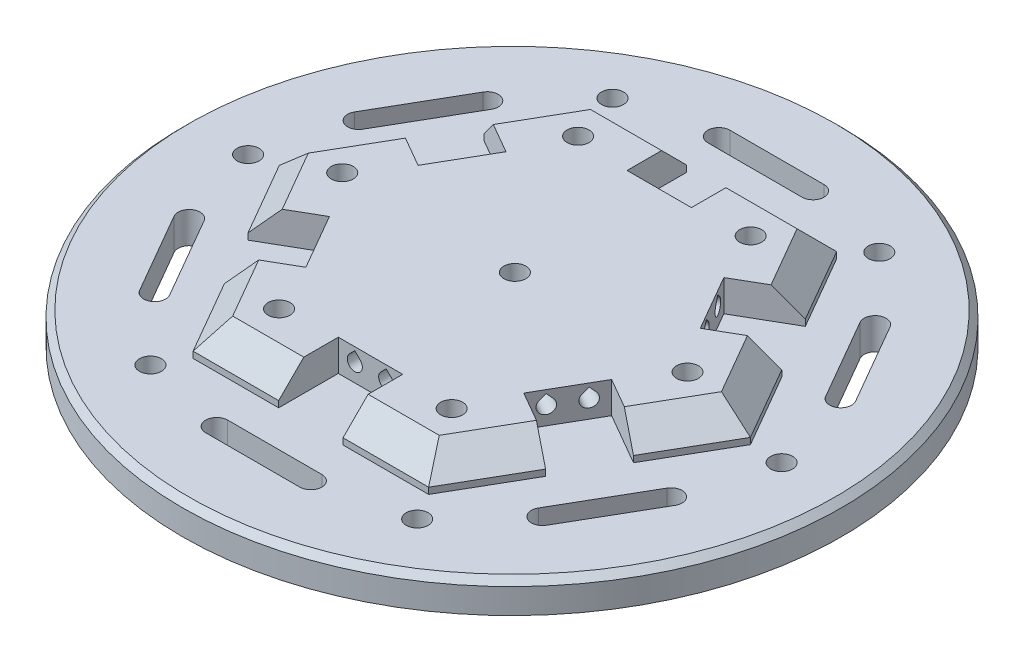
from build123d import *

# Parameters (mm, degrees)
EXTRUDE_1_DEPTH          = 10
CHAMFER_1_SIZE           = 8
SKETCH_1_3_W             = 20.5
SKETCH_1_3_H             = 19
CUT_EXTRUDE_2_DEPTH      = 10
CUT_EXTRUDE_3_DEPTH      = 8.5
PATTERN_CIRCULAR_1_COUNT = 6
SKETCH_9_R               = 105
EXTRUDE_3_DEPTH          = 10
SKETCH_7_R               = 3.5
CUT_EXTRUDE_4_DEPTH      = 151.473378259
CUT_EXTRUDE_5_DEPTH      = 150.473200156
PATTERN_CIRCULAR_2_COUNT = 6
CHAMFER_2_SIZE           = 2
SKETCH_13_R              = 3.5
CUT_EXTRUDE_6_DEPTH      = 151.473378259
PATTERN_CIRCULAR_3_COUNT = 6
CUT_EXTRUDE_7_DEPTH      = 0.6


with BuildPart() as part:
    # 草圖1 → 填料-伸長1 (new body)
    with BuildSketch(Plane(origin=(0, 0, 0), x_dir=(1, 0, 0), z_dir=(0, 1, 0))):
        Polygon((37.527767497, -65), (75.055534995, 0), (37.527767497, 65), (-37.527767497, 65), (-75.055534995, 0), (-37.527767497, -65), align=None)
    extrude(amount=EXTRUDE_1_DEPTH)

    # 導角1
    chamfer_1_edges = [part.edges().sort_by_distance(p)[0] for p in [
        (56.291651246, 10, 32.5),
        (0, 10, 65),
        (-56.291651246, 10, 32.5),
        (-56.291651246, 10, -32.5),
        (0, 10, -65),
        (56.291651246, 10, -32.5),
    ]]
    chamfer(chamfer_1_edges, length=CHAMFER_1_SIZE)

    # 草圖1<3> → 除料-伸長2 (cut)
    with BuildSketch(Plane(origin=(0, 0, 0), x_dir=(1, 0, 0), z_dir=(0, 1, 0))):
        with Locations((0, 55.5)):
            Rectangle(SKETCH_1_3_W, SKETCH_1_3_H)
    cut_extrude_2 = extrude(amount=CUT_EXTRUDE_2_DEPTH, mode=Mode.SUBTRACT)

    # 草圖2 → 除料-伸長3 (cut)
    with BuildSketch(Plane(origin=(0, 0, -46), x_dir=(-1, 0, 0), z_dir=(0, 0, -1))):
        with BuildLine():
            Line((-6.697056275, 7.197056275), (-5, 8.89411255))
            Line((-5, 8.89411255), (-3.302943725, 7.197056275))
            ThreePointArc((-3.302943725, 7.197056275), (-5, 3.1), (-6.697056275, 7.197056275))
        make_face()
        with BuildLine():
            Line((3.302943725, 7.197056275), (5, 8.89411255))
            Line((5, 8.89411255), (6.697056275, 7.197056275))
            ThreePointArc((6.697056275, 7.197056275), (5, 3.1), (3.302943725, 7.197056275))
        make_face()
    cut_extrude_3 = extrude(amount=-CUT_EXTRUDE_3_DEPTH, mode=Mode.SUBTRACT)

    # 環狀複製排列1: 除料-伸長2, 除料-伸長3 ×6 about axis
    pattern_circular_1_axis = Axis((0, 10.5, 0), (0, -1, 0))
    add([cut_extrude_2.rotate(pattern_circular_1_axis, i * 360 / PATTERN_CIRCULAR_1_COUNT) for i in range(1, PATTERN_CIRCULAR_1_COUNT)], mode=Mode.SUBTRACT)
    add([cut_extrude_3.rotate(pattern_circular_1_axis, i * 360 / PATTERN_CIRCULAR_1_COUNT) for i in range(1, PATTERN_CIRCULAR_1_COUNT)], mode=Mode.SUBTRACT)

    # 草圖9 → 填料-伸長3 (add)
    with BuildSketch(Plane.XZ):
        with Locations((0, 0.91146097)):
            Circle(SKETCH_9_R)
    extrude(amount=EXTRUDE_3_DEPTH)

    # 草圖7 → 除料-伸長4 (cut, through all)
    with BuildSketch(Plane(origin=(0, 10, 0), x_dir=(1, 0, 0), z_dir=(0, 1, 0))):
        Circle(SKETCH_7_R)
    extrude(amount=-CUT_EXTRUDE_4_DEPTH, mode=Mode.SUBTRACT)

    # 草圖10 → 除料-伸長5 (cut, through all)
    with BuildSketch(Plane(origin=(0, 0, 0), x_dir=(1, 0, 0), z_dir=(0, 1, 0))):
        with BuildLine():
            Line((-15, 83.5), (15, 83.5))
            ThreePointArc((15, 83.5), (18.5, 80), (15, 76.5))
            Line((15, 76.5), (-15, 76.5))
            ThreePointArc((-15, 76.5), (-18.5, 80), (-15, 83.5))
        make_face()
    cut_extrude_5 = extrude(amount=-CUT_EXTRUDE_5_DEPTH, mode=Mode.SUBTRACT)

    # 環狀複製排列2: 除料-伸長5 ×6 about axis
    pattern_circular_2_axis = Axis((0, 10.5, 0), (0, -1, 0))
    for i in range(1, PATTERN_CIRCULAR_2_COUNT):
        add(cut_extrude_5.rotate(pattern_circular_2_axis, i * 360 / PATTERN_CIRCULAR_2_COUNT), mode=Mode.SUBTRACT)

    # 導角2
    chamfer_2_edges = [part.edges().sort_by_distance(p)[0] for p in [
        (-105, 0, 0.91146097),
    ]]
    chamfer(chamfer_2_edges, length=CHAMFER_2_SIZE)

    # 草圖13 → 除料-伸長6 (cut, through all)
    with BuildSketch(Plane(origin=(0, 10, 0), x_dir=(1, 0, 0), z_dir=(0, 1, 0))):
        with Locations((27.5, 47.631397208)):
            Circle(SKETCH_13_R)
        with Locations((42.5, 73.612159322)):
            Circle(SKETCH_13_R)
    cut_extrude_6 = extrude(amount=-CUT_EXTRUDE_6_DEPTH, mode=Mode.SUBTRACT)

    # 環狀複製排列3: 除料-伸長6 ×6 about axis
    pattern_circular_3_axis = Axis((0, 10.5, 0), (0, -1, 0))
    for i in range(1, PATTERN_CIRCULAR_3_COUNT):
        add(cut_extrude_6.rotate(pattern_circular_3_axis, i * 360 / PATTERN_CIRCULAR_3_COUNT), mode=Mode.SUBTRACT)

    # 草圖15 → 除料-伸長7 (cut)
    with BuildSketch(Plane.XZ.offset(10)):
        with BuildLine():
            add(Edge.make_bspline(
                [(-4.746169857, -37.085110055), (-4.559376239, -36.886463314), (-4.158030581, -36.459649977), (-3.585683664, -35.706236944), (-2.968834639, -34.825070445), (-2.319103791, -33.803340329), (-1.633537943, -32.647440685), (-0.916812476, -31.353124773), (-0.151270509, -29.928638507), (0.347443297, -28.920909866), (0.607091013, -28.39625136)],
                knots=[0, 0, 0, 0, 0.638779608, 1.372484911, 2.214797435, 3.160111188, 4.209727821, 5.364596358, 6.627917397, 8, 8, 8, 8], degree=3))
            add(Edge.make_bspline(
                [(0.607091013, -28.39625136), (0.748913447, -28.108236688), (1.014217979, -27.569453117), (1.396527321, -26.824258504), (1.719570471, -26.189637697), (1.926557667, -25.809813758), (2.020134491, -25.638099186)],
                knots=[0, 0, 0, 0, 1.242995627, 2.325248287, 3.242861638, 4, 4, 4, 4], degree=3))
            add(Edge.make_bspline(
                [(2.020134491, -25.638099186), (2.2905929, -25.1275573), (2.830019464, -24.10928667), (3.741810164, -22.643041898), (4.712424332, -21.220390521), (5.742385586, -19.862994986), (6.7962859, -18.595420648), (7.87600457, -17.474332117), (8.935647777, -16.481340781), (9.68262718, -15.921803424), (10.043232317, -15.651686142)],
                knots=[0, 0, 0, 0, 1.073257855, 2.140601943, 3.206161346, 4.272410075, 5.305729299, 6.2669797, 7.163382524, 8, 8, 8, 8], degree=3))
            add(Edge.make_bspline(
                [(10.043232317, -15.651686142), (9.804708124, -15.447606735), (9.319305517, -15.032300116), (8.50653945, -14.489326435), (7.609913323, -14.018122147), (6.647199322, -13.591965125), (5.601559721, -13.250193432), (4.474645259, -13.009617543), (3.269845127, -12.855897179), (2.439552439, -12.840365493), (2.013341013, -12.832392664)],
                knots=[0, 0, 0, 0, 0.86469134, 1.759668174, 2.686716289, 3.653808018, 4.658458515, 5.712534823, 6.825782994, 8, 8, 8, 8], degree=3))
            add(Edge.make_bspline(
                [(2.013341013, -12.832392664), (1.489096063, -12.851289952), (0.444536311, -12.888942858), (-1.102506093, -13.174326924), (-2.605282563, -13.656635783), (-3.81588332, -14.20469685), (-4.751571454, -14.733534281), (-5.43356334, -15.18470385), (-6.090739128, -15.682748946), (-6.734655486, -16.217527173), (-7.344321486, -16.813112842), (-7.933867832, -17.450160815), (-8.503876461, -18.132887195), (-8.85456321, -18.618243202), (-9.032854639, -18.86500136)],
                knots=[0, 0, 0, 0, 1.440299355, 2.869801105, 4.306640576, 5.768931729, 6.513093068, 7.258788307, 8.014339545, 8.778530887, 9.557580804, 10.354717427, 11.163527615, 12, 12, 12, 12], degree=3))
            add(Edge.make_bspline(
                [(-9.032854639, -18.86500136), (-9.237805132, -19.16623477), (-9.646626128, -19.767114237), (-10.195838157, -20.702950858), (-10.68042307, -21.668778545), (-11.101997443, -22.643336559), (-11.448193874, -23.599681854), (-11.692652844, -24.50643923), (-11.856944776, -25.346822623), (-11.876687376, -25.888791392), (-11.886115509, -26.147610055)],
                knots=[0, 0, 0, 0, 1.103188463, 2.200563657, 3.28320397, 4.373700348, 5.414886093, 6.359812638, 7.216724053, 8, 8, 8, 8], degree=3))
            add(Edge.make_bspline(
                [(-11.886115509, -26.147610055), (-11.876272823, -26.395354947), (-11.857539938, -26.866870194), (-11.702175182, -27.526974013), (-11.443346736, -28.097281889), (-11.06888711, -28.558237662), (-10.616082965, -28.912301986), (-10.109738635, -29.166431153), (-9.557222915, -29.332599639), (-9.169942088, -29.346841918), (-8.971713335, -29.354131794)],
                knots=[0, 0, 0, 0, 1.21450397, 2.311479106, 3.305708342, 4.261951616, 5.195653451, 6.105102627, 7.03010137, 8, 8, 8, 8], degree=3))
            add(Edge.make_bspline(
                [(-8.971713335, -29.354131794), (-8.70377923, -29.343063254), (-8.165717227, -29.320835545), (-7.368616846, -29.158961184), (-6.586867322, -28.897591957), (-5.819406929, -28.534409355), (-5.071447278, -28.059160667), (-4.335373687, -27.487156846), (-3.621872924, -26.804873411), (-2.923730349, -26.044433224), (-2.282060524, -25.210452514), (-1.705096135, -24.34329487), (-1.232291979, -23.440436613), (-0.830902089, -22.518909311), (-0.526298549, -21.566977845), (-0.311592317, -20.591084268), (-0.165687605, -19.591763657), (-0.153271327, -18.915346093), (-0.146985074, -18.572881794)],
                knots=[0, 0, 0, 0, 0.842829404, 1.692559738, 2.548898225, 3.431893729, 4.357238406, 5.332261245, 6.360667712, 7.460331196, 8.577860171, 9.668900164, 10.733650716, 11.780726535, 12.828674998, 13.872934002, 14.923085083, 16, 16, 16, 16], degree=3))
            add(Edge.make_bspline(
                [(-0.146985074, -18.572881794), (-0.148940481, -18.532099125), (-0.15329199, -18.441342483), (-0.166716353, -18.305602011), (-0.179768871, -18.183489226), (-0.185571877, -18.110933864), (-0.187745944, -18.08375136)],
                knots=[0, 0, 0, 0, 0.997940782, 2.220790257, 3.333427962, 4, 4, 4, 4], degree=3))
            add(Edge.make_bspline(
                [(-0.187745944, -18.08375136), (-0.174224723, -17.912642499), (-0.148219954, -17.583556347), (0.008148313, -17.196504464), (0.213192393, -16.966689496), (0.389034695, -16.829311494), (0.605246383, -16.763360276), (0.753966718, -16.751566753), (0.831275795, -16.745436142)],
                knots=[0, 0, 0, 0, 1.639623284, 3.153415412, 3.875057916, 4.572881607, 5.258143105, 6, 6, 6, 6], degree=3))
            add(Edge.make_bspline(
                [(0.831275795, -16.745436142), (0.967514932, -16.750467585), (1.219744238, -16.759782656), (1.571979523, -16.831694309), (1.863384024, -16.965606644), (2.144266696, -17.211119227), (2.399581849, -17.566197872), (2.441709097, -17.894100143), (2.461710578, -18.049783968)],
                knots=[0, 0, 0, 0, 1.049200078, 1.942459517, 2.754116877, 3.484641841, 4.80573996, 6, 6, 6, 6], degree=3))
            add(Edge.make_bspline(
                [(2.461710578, -18.049783968), (2.450894092, -18.464661573), (2.429479309, -19.28604793), (2.269494155, -20.502970077), (2.003982899, -21.686991391), (1.635540133, -22.839590526), (1.16553404, -23.959551531), (0.584998042, -25.044075651), (-0.10756881, -26.092048605), (-0.884150329, -27.097778467), (-1.729972157, -28.031584814), (-2.633540089, -28.848669491), (-3.577649115, -29.541875823), (-4.559555329, -30.112214213), (-5.585446626, -30.548105402), (-6.649261372, -30.863253169), (-7.752878999, -31.060484395), (-8.504412888, -31.082274078), (-8.883398118, -31.093262229)],
                knots=[0, 0, 0, 0, 1.042978701, 2.064918581, 3.080238332, 4.090436155, 5.103518248, 6.130095241, 7.178716062, 8.258397033, 9.322409897, 10.342380964, 11.31610429, 12.262474159, 13.191051161, 14.111650926, 15.047739008, 16, 16, 16, 16], degree=3))
            add(Edge.make_bspline(
                [(-8.883398118, -31.093262229), (-9.123647883, -31.085655062), (-9.596692628, -31.070676773), (-10.293956951, -30.984453688), (-10.957075542, -30.82628595), (-11.59352809, -30.614841576), (-12.197219316, -30.336635378), (-12.769159397, -29.991855661), (-13.319038902, -29.599358497), (-13.82096651, -29.137662721), (-14.283638955, -28.636386335), (-14.690297377, -28.102853041), (-15.03542658, -27.538915976), (-15.313760948, -26.946001248), (-15.531746699, -26.324548486), (-15.690147586, -25.676504603), (-15.776650289, -24.999579219), (-15.7915759, -24.540046884), (-15.799158987, -24.306577447)],
                knots=[0, 0, 0, 0, 1.066792316, 2.100482794, 3.112435978, 4.088396114, 5.073477812, 6.056197078, 7.049553914, 8.067282906, 9.077586938, 10.074852945, 11.040350207, 12.007207252, 12.976934477, 13.959550899, 14.963331917, 16, 16, 16, 16], degree=3))
            add(Edge.make_bspline(
                [(-15.799158987, -24.306577447), (-15.785565405, -23.952435565), (-15.758430074, -23.24550219), (-15.555064369, -22.199051839), (-15.219065505, -21.176686973), (-14.741365448, -20.179684713), (-14.138328599, -19.192139943), (-13.39135447, -18.224605302), (-12.518257557, -17.259409379), (-11.859667168, -16.656329309), (-11.519267683, -16.344620925)],
                knots=[0, 0, 0, 0, 0.9107558, 1.81803877, 2.731882833, 3.672722676, 4.655956658, 5.703542789, 6.813051531, 8, 8, 8, 8], degree=3))
            add(Edge.make_bspline(
                [(-11.519267683, -16.344620925), (-11.036928872, -15.946141143), (-10.075909235, -15.152203588), (-8.516918698, -14.12438596), (-6.888009468, -13.220222286), (-5.190287333, -12.466896196), (-3.465698432, -11.854473094), (-1.737821639, -11.416675714), (-0.024151053, -11.147182741), (1.115670334, -11.111127753), (1.680460578, -11.093262229)],
                knots=[0, 0, 0, 0, 1.035329621, 2.06280746, 3.086563448, 4.117163259, 5.134658273, 6.113194017, 7.065073157, 8, 8, 8, 8], degree=3))
            add(Edge.make_bspline(
                [(1.680460578, -11.093262229), (2.201811794, -11.104654053), (3.220708133, -11.126917523), (4.706772299, -11.310676629), (6.107011376, -11.624878256), (7.414747689, -12.050574153), (8.619013941, -12.573395053), (9.687533082, -13.201605236), (10.634812235, -13.903134552), (11.149510246, -14.465543821), (11.401927969, -14.741360055)],
                knots=[0, 0, 0, 0, 1.169643645, 2.28587868, 3.35349345, 4.385154294, 5.368043932, 6.292726679, 7.162720595, 8, 8, 8, 8], degree=3))
            add(Edge.make_bspline(
                [(11.401927969, -14.741360055), (11.626033086, -14.539653362), (12.090479872, -14.121626203), (12.783087181, -13.746942465), (13.349895067, -13.510701391), (13.723948926, -13.371157293), (14.043466852, -13.289429174), (14.236751619, -13.274048391), (14.323123622, -13.267175273)],
                knots=[0, 0, 0, 0, 1.627130563, 3.372147735, 4.223397926, 4.952124642, 5.531742231, 6, 6, 6, 6], degree=3))
            add(Edge.make_bspline(
                [(14.323123622, -13.267175273), (14.428554231, -13.285612157), (14.643384775, -13.323180051), (14.947854411, -13.460794494), (15.240255209, -13.632244184), (15.395259383, -13.797568644), (15.471221448, -13.878588316)],
                knots=[0, 0, 0, 0, 0.963205536, 1.962674498, 3.00157881, 4, 4, 4, 4], degree=3))
            add(Edge.make_bspline(
                [(15.471221448, -13.878588316), (15.451555469, -13.951691155), (15.403974971, -14.128558509), (15.149910806, -14.357550422), (14.772203679, -14.586338437), (14.281874536, -14.814150207), (13.764484041, -15.045622642), (13.297672915, -15.287264494), (12.910421223, -15.521909603), (12.695723023, -15.694894063), (12.597580143, -15.773968751)],
                knots=[0, 0, 0, 0, 0.509076556, 1.23167615, 2.240612878, 3.54880215, 4.912920425, 6.11739671, 7.139424041, 8, 8, 8, 8], degree=3))
            add(Edge.make_bspline(
                [(12.597580143, -15.773968751), (12.868812056, -16.083743213), (13.400542057, -16.691033017), (14.079851836, -17.674420594), (14.665136966, -18.678679355), (15.125606192, -19.724975842), (15.48795977, -20.800633692), (15.758521977, -21.910744705), (15.905487259, -23.066206384), (15.928371727, -23.848769259), (15.939971448, -24.245436142)],
                knots=[0, 0, 0, 0, 1.058471196, 2.075054094, 3.069357827, 4.044776513, 5.010139697, 5.986549547, 6.979418596, 8, 8, 8, 8], degree=3))
            add(Edge.make_bspline(
                [(15.939971448, -24.245436142), (15.927837084, -24.751237414), (15.903294921, -25.774237705), (15.670244585, -27.311862979), (15.321688046, -28.868334639), (14.813373936, -30.421439257), (14.192160443, -31.958144438), (13.422339246, -33.435361352), (12.543223311, -34.8600881), (11.856361011, -35.743632232), (11.510623622, -36.188370925)],
                knots=[0, 0, 0, 0, 0.93480435, 1.890673622, 2.869995958, 3.881800922, 4.909103822, 5.931744274, 6.95892767, 8, 8, 8, 8], degree=3))
            add(Edge.make_bspline(
                [(11.510623622, -36.188370925), (11.213075542, -36.542599879), (10.618208166, -37.250785421), (9.576051745, -38.176230309), (8.453017237, -39.019754299), (7.239434379, -39.745475133), (5.972765998, -40.345118516), (4.67383561, -40.778328566), (3.357499867, -41.038498475), (2.474152221, -41.075041927), (2.033721448, -41.093262229)],
                knots=[0, 0, 0, 0, 1.006778137, 2.012782164, 3.028228374, 4.063970562, 5.088177881, 6.075852648, 7.040633989, 8, 8, 8, 8], degree=3))
            add(Edge.make_bspline(
                [(2.033721448, -41.093262229), (1.538838204, -41.074144813), (0.552981306, -41.036061008), (-0.662661654, -40.800865582), (-1.61383294, -40.526938883), (-2.314839958, -40.2460378), (-3.016288322, -39.934069069), (-3.466374692, -39.679449642), (-3.693180726, -39.551142664)],
                knots=[0, 0, 0, 0, 1.483746338, 2.955771046, 3.699383371, 4.449881285, 5.218869309, 6, 6, 6, 6], degree=3))
            add(Edge.make_bspline(
                [(-3.693180726, -39.551142664), (-3.915792299, -39.667656641), (-4.371387711, -39.906113399), (-5.099077933, -40.207872364), (-5.87904052, -40.475858804), (-6.984788638, -40.767141446), (-8.409418804, -41.033969443), (-9.565930842, -41.073589214), (-10.140191596, -41.093262229)],
                knots=[0, 0, 0, 0, 0.675429286, 1.382329235, 2.116079239, 2.891626604, 4.456551432, 6, 6, 6, 6], degree=3))
            add(Edge.make_bspline(
                [(-10.140191596, -41.093262229), (-10.573156385, -41.085627861), (-11.398928892, -41.071067205), (-12.571590995, -40.922170375), (-13.614727091, -40.678217081), (-14.397988103, -40.401518316), (-14.934491185, -40.112977905), (-15.282765401, -39.889152029), (-15.572651512, -39.637670856), (-15.819246952, -39.370684209), (-16.002212191, -39.07664186), (-16.134334157, -38.762554944), (-16.21871753, -38.430091081), (-16.228843367, -38.199733467), (-16.233941596, -38.08375136)],
                knots=[0, 0, 0, 0, 2.08543906, 3.977455641, 5.681840159, 7.242409336, 7.959981731, 8.613653, 9.232617423, 9.804389489, 10.358395049, 10.891371336, 11.441819669, 12, 12, 12, 12], degree=3))
            add(Edge.make_bspline(
                [(-16.233941596, -38.08375136), (-16.220212901, -37.87904173), (-16.193286677, -37.477542724), (-15.918222386, -36.926288048), (-15.494217516, -36.452920849), (-14.898151235, -36.090326168), (-14.187446778, -35.794932236), (-13.364782875, -35.591656105), (-12.447491825, -35.459177909), (-11.802853476, -35.447309826), (-11.464919857, -35.441088316)],
                knots=[0, 0, 0, 0, 0.807634513, 1.584021494, 2.392856803, 3.303345621, 4.327185258, 5.441793958, 6.658932055, 8, 8, 8, 8], degree=3))
            add(Edge.make_bspline(
                [(-11.464919857, -35.441088316), (-11.22691167, -35.443880395), (-10.74292892, -35.449558006), (-10.004529567, -35.534465211), (-9.238771464, -35.643634363), (-8.441329481, -35.819582224), (-7.599845482, -36.049302526), (-6.695611636, -36.321569128), (-5.739851041, -36.683082362), (-5.085283709, -36.947909953), (-4.746169857, -37.085110055)],
                knots=[0, 0, 0, 0, 0.819926092, 1.667295947, 2.559258351, 3.485501409, 4.479548286, 5.565906437, 6.738961138, 8, 8, 8, 8], degree=3))
        make_face()
        with BuildLine():
            add(Edge.make_bspline(
                [(-5.928235074, -38.382664403), (-6.382373805, -38.241091501), (-7.334684841, -37.9442187), (-8.558558875, -37.625511696), (-9.577602591, -37.402010676), (-10.335309488, -37.264607918), (-11.074328239, -37.201026084), (-11.55994901, -37.187059445), (-11.797800292, -37.180218751)],
                knots=[0, 0, 0, 0, 1.423591856, 2.985216063, 3.78281173, 4.546035301, 5.287865371, 6, 6, 6, 6], degree=3))
            add(Edge.make_bspline(
                [(-11.797800292, -37.180218751), (-11.951768349, -37.183401498), (-12.235237456, -37.189261224), (-12.627706261, -37.216310848), (-12.945955901, -37.285016742), (-13.203283664, -37.368563892), (-13.396573965, -37.494452368), (-13.535423142, -37.658584822), (-13.609849793, -37.86520276), (-13.619947871, -38.01300086), (-13.625245944, -38.090544838)],
                knots=[0, 0, 0, 0, 1.604897211, 2.954760805, 4.088367791, 4.991329553, 5.756863992, 6.460657976, 7.192366448, 8, 8, 8, 8], degree=3))
            add(Edge.make_bspline(
                [(-13.625245944, -38.090544838), (-13.614114595, -38.174878599), (-13.590244982, -38.355720506), (-13.392149622, -38.589785848), (-13.11321853, -38.810654341), (-12.720433955, -39.000708378), (-12.2344993, -39.160737087), (-11.658844604, -39.269734772), (-11.002869965, -39.348601573), (-10.536765928, -39.352215678), (-10.289648118, -39.354131794)],
                knots=[0, 0, 0, 0, 0.525400106, 1.126646744, 1.856444656, 2.767578871, 3.848843368, 5.069846004, 6.446498672, 8, 8, 8, 8], degree=3))
            add(Edge.make_bspline(
                [(-10.289648118, -39.354131794), (-10.069751209, -39.35119824), (-9.637911344, -39.34543724), (-9.010111902, -39.271661431), (-8.410819646, -39.176058734), (-7.681648989, -38.972673183), (-6.859307923, -38.698696058), (-6.222539452, -38.482559379), (-5.928235074, -38.382664403)],
                knots=[0, 0, 0, 0, 0.880000575, 1.728170408, 2.52871184, 3.307332153, 4.755491251, 6, 6, 6, 6], degree=3))
        make_face(mode=Mode.SUBTRACT)
        with BuildLine():
            add(Edge.make_bspline(
                [(-0.839919857, -38.260381794), (-0.547731438, -38.341795399), (0.013297974, -38.498117225), (0.826520767, -38.726752647), (1.605853508, -38.892979082), (2.121238218, -38.910685932), (2.373395361, -38.919349186)],
                knots=[0, 0, 0, 0, 1.105754369, 2.123153021, 3.081733777, 4, 4, 4, 4], degree=3))
            add(Edge.make_bspline(
                [(2.373395361, -38.919349186), (2.684366644, -38.909078951), (3.303814138, -38.888620884), (4.222628043, -38.717323488), (5.123338208, -38.445794198), (6.004489457, -38.060773599), (6.863576129, -37.569421792), (7.691733663, -36.967484147), (8.494712559, -36.264289346), (8.983917943, -35.729132223), (9.234808404, -35.454675273)],
                knots=[0, 0, 0, 0, 0.940395542, 1.873245839, 2.81839799, 3.782073927, 4.776517149, 5.807315923, 6.875475336, 8, 8, 8, 8], degree=3))
            add(Edge.make_bspline(
                [(9.234808404, -35.454675273), (9.528714795, -35.103231586), (10.132487922, -34.381259351), (10.89433384, -33.146780481), (11.592944879, -31.784426494), (12.197373202, -30.308736657), (12.691666338, -28.774970634), (13.066705363, -27.246598929), (13.282545527, -25.741656178), (13.315178584, -24.748785587), (13.331275795, -24.259023099)],
                knots=[0, 0, 0, 0, 0.904062901, 1.857220194, 2.857594428, 3.926790818, 5.003401812, 6.038541645, 7.032453238, 8, 8, 8, 8], degree=3))
            add(Edge.make_bspline(
                [(13.331275795, -24.259023099), (13.322504616, -23.905506179), (13.305258032, -23.210393412), (13.196984953, -22.185266789), (13.007371255, -21.196712278), (12.647960332, -19.945566809), (12.122990403, -18.4623823), (11.592223985, -17.339365522), (11.333993187, -16.79299049)],
                knots=[0, 0, 0, 0, 0.815772473, 1.604035986, 2.37572326, 3.135140934, 4.606176244, 6, 6, 6, 6], degree=3))
            add(Edge.make_bspline(
                [(11.333993187, -16.79299049), (11.25704314, -16.941418848), (11.082869918, -17.277380249), (10.849428156, -17.863821396), (10.573026837, -18.570073153), (10.286566756, -19.411858919), (9.957121089, -20.375514811), (9.62234199, -21.474709195), (9.25399784, -22.697087159), (9.005229644, -23.556771486), (8.874754056, -24.007664403)],
                knots=[0, 0, 0, 0, 0.525487467, 1.189418974, 1.982932388, 2.91084416, 3.985038238, 5.185596104, 6.523882842, 8, 8, 8, 8], degree=3))
            add(Edge.make_bspline(
                [(8.874754056, -24.007664403), (8.730871806, -24.497110035), (8.458704667, -25.422943603), (8.05859936, -26.725319221), (7.69417593, -27.866139003), (7.447358206, -28.566595188), (7.332634491, -28.892175273)],
                knots=[0, 0, 0, 0, 1.194987865, 2.260434678, 3.191430047, 4, 4, 4, 4], degree=3))
            add(Edge.make_bspline(
                [(7.332634491, -28.892175273), (7.131227249, -29.39900237), (6.732188938, -30.403154093), (5.975015906, -31.82976369), (5.104755775, -33.171404882), (4.120778698, -34.420509817), (3.031566174, -35.56765286), (1.838317944, -36.594407362), (0.551734652, -37.509604471), (-0.374569081, -38.009331834), (-0.839919857, -38.260381794)],
                knots=[0, 0, 0, 0, 1.027707056, 2.036145694, 3.039255162, 4.039525377, 5.030116231, 6.017037843, 7.003811661, 8, 8, 8, 8], degree=3))
        make_face(mode=Mode.SUBTRACT)
    extrude(amount=-CUT_EXTRUDE_7_DEPTH, mode=Mode.SUBTRACT)


solid = part.part
